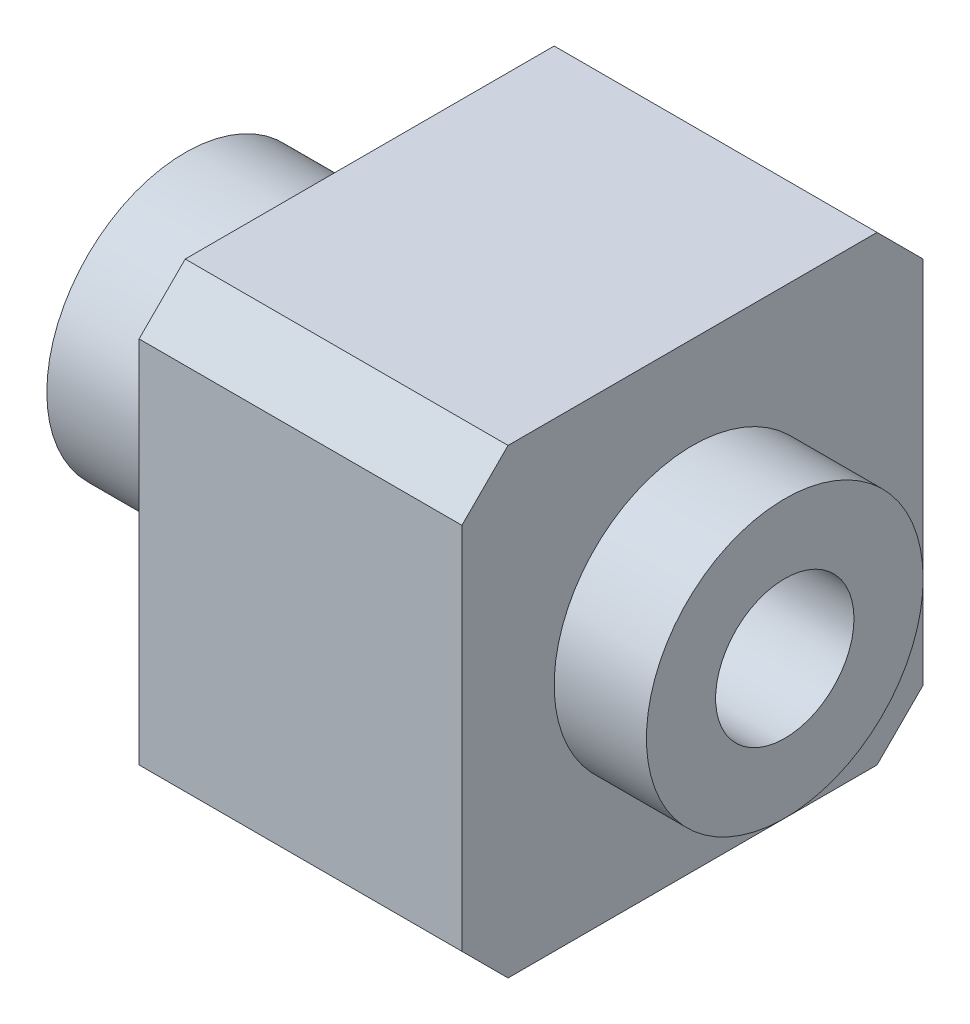
from build123d import *

# Parameters (mm, degrees)
SKETCH1_W           = 10
SKETCH1_H           = 10
BOSS_EXTRUDE1_DEPTH = 13
SKETCH2_R           = 15.353568197
SKETCH2_R_2         = 3
CUT_EXTRUDE1_DEPTH  = 2
CUT_EXTRUDE2_START  = -4
SKETCH3_R           = 15.635411304
SKETCH3_R_2         = 3
CUT_EXTRUDE2_DEPTH  = 4
SKETCH4_R           = 1.5
CUT_EXTRUDE3_DEPTH  = 15.798648587
CHAMFER1_SIZE       = 1
CUT_EXTRUDE4_START  = 5
SKETCH5_R           = 1.5
CUT_EXTRUDE4_DEPTH  = 2


with BuildPart() as part:
    # Sketch1 → Boss-Extrude1 (new body)
    with BuildSketch(Plane(origin=(0, 0, 0), x_dir=(0, 0, -1), z_dir=(1, 0, 0))):
        Rectangle(SKETCH1_W, SKETCH1_H)
    extrude(amount=-BOSS_EXTRUDE1_DEPTH)

    # Sketch2 → Cut-Extrude1 (cut)
    with BuildSketch(Plane(origin=(0, 0, 0), x_dir=(0, 0, -1), z_dir=(1, 0, 0))):
        Circle(SKETCH2_R)
        Circle(SKETCH2_R_2, mode=Mode.SUBTRACT)
    extrude(amount=-CUT_EXTRUDE1_DEPTH, mode=Mode.SUBTRACT)

    # Sketch3 → Cut-Extrude2 (cut)
    with BuildSketch(Plane.ZY.offset(13).offset(CUT_EXTRUDE2_START)):
        Circle(SKETCH3_R)
        with Locations(Location((0, 0, 0), (0, 0, 180))):
            Circle(SKETCH3_R_2, mode=Mode.SUBTRACT)
    extrude(amount=CUT_EXTRUDE2_DEPTH, mode=Mode.SUBTRACT)

    # Sketch4 → Cut-Extrude3 (cut, through all)
    with BuildSketch(Plane(origin=(0, 0, 0), x_dir=(0, 0, -1), z_dir=(1, 0, 0))):
        Circle(SKETCH4_R)
    extrude(amount=-CUT_EXTRUDE3_DEPTH, mode=Mode.SUBTRACT)

    # Chamfer1
    chamfer1_edges = [part.edges().sort_by_distance(p)[0] for p in [
        (-5.5, -5, -5),
        (-5.5, -5, 5),
        (-5.5, 5, -5),
        (-5.5, 5, 5),
    ]]
    chamfer(chamfer1_edges, length=CHAMFER1_SIZE)

    # Sketch5 → Cut-Extrude4 (cut)
    with BuildSketch(Plane(origin=(0, 0, 0), x_dir=(-1, 0, 0), z_dir=(0, 0, -1)).offset(CUT_EXTRUDE4_START)):
        with Locations((5.5, 0)):
            Circle(SKETCH5_R)
    extrude(amount=-CUT_EXTRUDE4_DEPTH, mode=Mode.SUBTRACT)


solid = part.part
